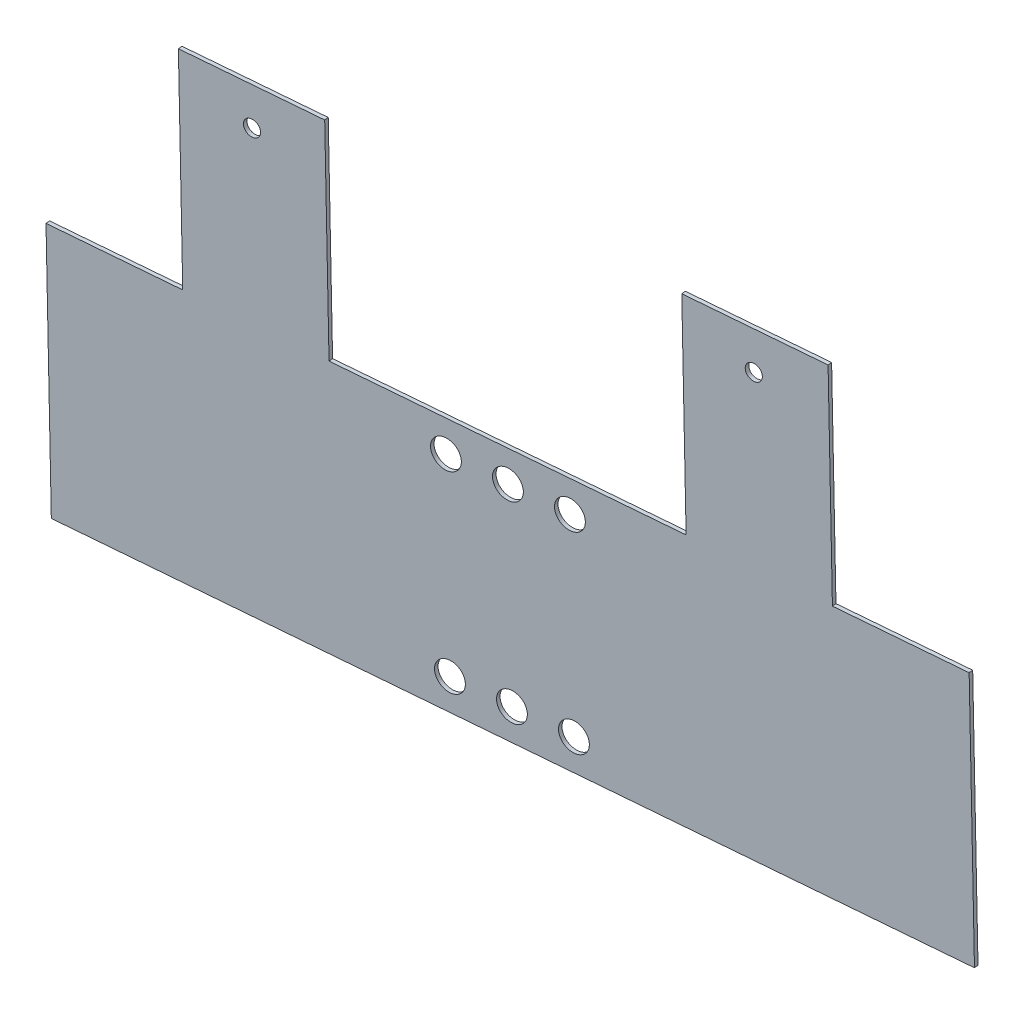
from build123d import *

# Parameters (mm, degrees)
BOSS_EXTRUDE1_DEPTH = 0.6096
SKETCH5_R           = 2.25
CUT_EXTRUDE2_DEPTH  = 0.6096
SKETCH6_R           = 1.25
CUT_EXTRUDE5_DEPTH  = 0.6096
SKETCH7_R           = 1.25
CUT_EXTRUDE6_DEPTH  = 0.6096


with BuildPart() as part:
    # Sketch1 → Boss-Extrude1 (new body)
    with BuildSketch(Plane(origin=(16.997226787, -4.149929847, 204.631375634), x_dir=(0.9965694099183702, 0.001959509651517015, -0.0827379691367708), z_dir=(-0.08276069418699705, 0.020206300667429095, -0.9963645783100802))):
        Polygon((-405.631572024, 283.216979703), (-385.692572024, 283.216979703), (-385.692572024, 323.856979703), (-405.014358213, 323.856979703), (-432.414358217, 323.856979703), (-445.097076418, 323.856979703), (-465.359895626, 323.856979703), (-479.498480719, 323.856979703), (-500.373572024, 323.856979703), (-520.312572024, 323.856979703), (-520.312572024, 283.216979703), (-500.373572024, 283.216979703), (-500.373572024, 250.003685703), (-479.037572024, 250.003685703), (-479.037572024, 283.216979703), (-426.967572024, 283.216979703), (-426.967572024, 250.003685703), (-405.631572024, 250.003685703), align=None)
    extrude(amount=BOSS_EXTRUDE1_DEPTH)

    # Sketch5 → Cut-Extrude2 (cut)
    with BuildSketch(Plane(origin=(16.946775868, -4.137612086, 204.023991787), x_dir=(-0.9965694494101686, -0.0016780440853138524, 0.08274368054637986), z_dir=(-0.08276069418699686, 0.020206300667429084, -0.9963645783100801))):
        with Locations(Location((461.99617795, -318.987055127, 0), (0, 0, 0.096164523))):
            Circle(SKETCH5_R)
        with Locations(Location((452.956635294, -318.984510283, 0), (0, 0, 0.096164523))):
            Circle(SKETCH5_R)
        with Locations(Location((443.917092638, -318.981965439, 0), (0, 0, 0.096164523))):
            Circle(SKETCH5_R)
    cut_extrude2 = extrude(amount=-CUT_EXTRUDE2_DEPTH, mode=Mode.SUBTRACT)

    # Mirror1: Cut-Extrude2 across plane
    add(cut_extrude2.mirror(Plane(origin=(0.085159645, -303.474424262, -6.16154314), x_dir=(5.696257509048788e-06, -0.020299150712569557, 0.9997939509958544), z_dir=(0.00028055772663953236, -0.9997939116314238, -0.02029915151179878))), mode=Mode.SUBTRACT)

    # Sketch6 → Cut-Extrude5 (cut)
    with BuildSketch(Plane(origin=(16.946775868, -4.137612086, 204.023991787), x_dir=(-0.9965694494101686, -0.0016780440853136297, 0.08274368054637984), z_dir=(-0.08276069418699684, 0.020206300667429112, -0.9963645783100802))):
        with Locations(Location((416.50680125, -256.173836565, 0), (0, 0, 0.096164523))):
            Circle(SKETCH6_R)
    extrude(amount=-CUT_EXTRUDE5_DEPTH, mode=Mode.SUBTRACT)

    # Sketch7 → Cut-Extrude6 (cut)
    with BuildSketch(Plane(origin=(16.946775868, -4.137612086, 204.023991787), x_dir=(-0.9965694494101686, -0.0016780440853141855, 0.08274368054637984), z_dir=(-0.08276069418699686, 0.02020630066742906, -0.9963645783100802))):
        with Locations(Location((489.681466673, -256.194436956, 0), (0, 0, 0.096164523))):
            Circle(SKETCH7_R)
    extrude(amount=-CUT_EXTRUDE6_DEPTH, mode=Mode.SUBTRACT)


solid = part.part
